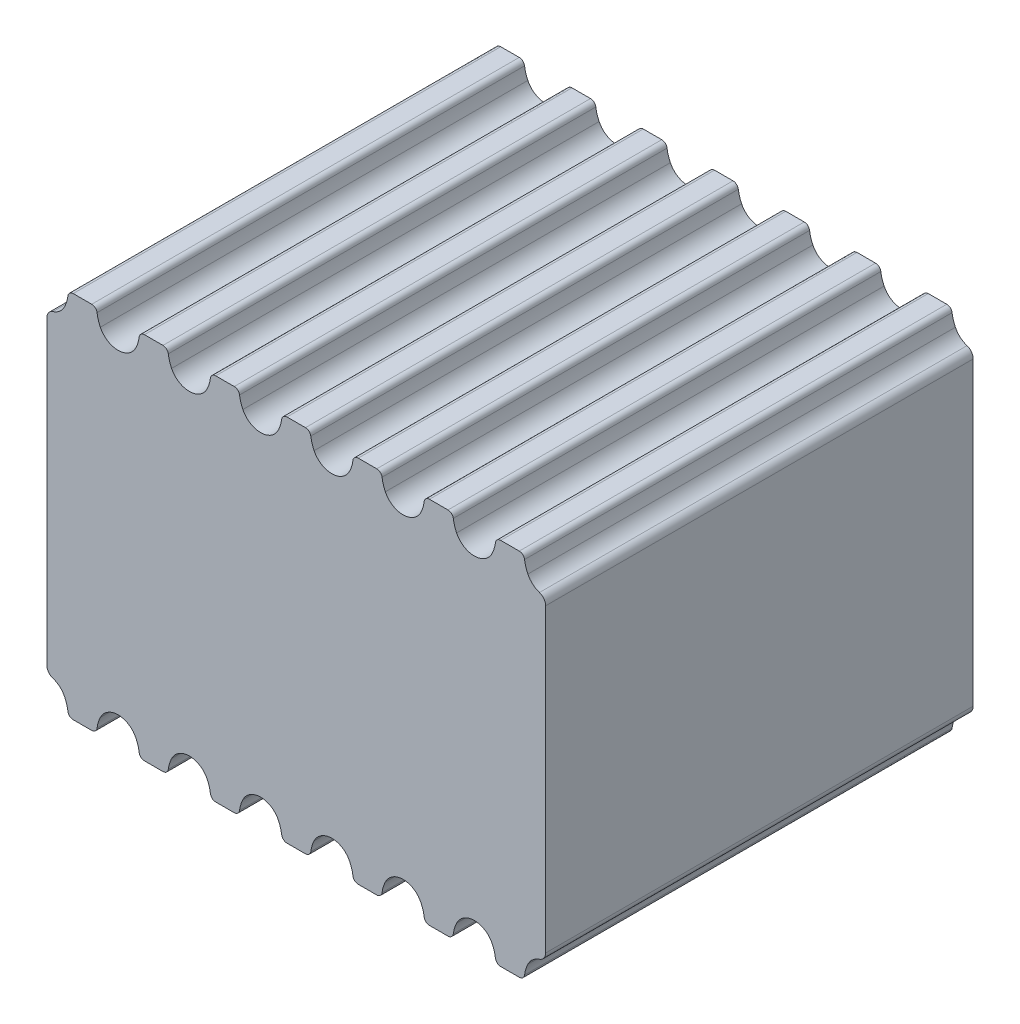
from build123d import *

# Parameters (mm, degrees)
BOSS_EXTRUDE1_DEPTH = 6.35
LPATTERN1_COUNT     = 7
LPATTERN1_PITCH     = 2
SKETCH4_W           = 14
SKETCH4_H           = 5.95
BOSS_EXTRUDE3_DEPTH = 6
FILLET1_R           = 0.25


with BuildPart() as part:
    # Sketch1 → Boss-Extrude1 (new, symmetric)
    with BuildSketch(Plane.XY):
        with BuildLine():
            Line((0, 0), (0, -0.254))
            Line((0, -0.254), (0.259824575, -0.254))
            ThreePointArc((0.259824575, -0.254), (0.358731646, -0.291228588), (0.408543109, -0.384434783))
            ThreePointArc((0.408543109, -0.384434783), (0.442388286, -0.542062154), (0.501123596, -0.692202247))
            ThreePointArc((0.501123596, -0.692202247), (0.705850588, -0.919639059), (1, -1.004))
            Line((1, -1.004), (1, 0))
            Line((1, 0), (1, 0.516))
            Line((1, 0.516), (0, 0.516))
            Line((0, 0.516), (0, 0))
        make_face()
    extrude(amount=BOSS_EXTRUDE1_DEPTH, both=True)

    # Mirror1: part across plane


with BuildPart() as part_1:
    add(part.part)
    add(part.part.mirror(Plane(origin=(0, 0, 6.35), x_dir=(0, 0, 1), z_dir=(1, 0, 0))))


with BuildPart() as lpattern1_1:
    # LPattern1: pattern copy
    add(part_1.part.moved(Location(Vector(-1, 0, 0) * (1 * LPATTERN1_PITCH))))


with BuildPart() as lpattern1_2:
    # LPattern1: pattern copy
    add(part_1.part.moved(Location(Vector(-1, 0, 0) * (2 * LPATTERN1_PITCH))))


with BuildPart() as lpattern1_3:
    # LPattern1: pattern copy
    add(part_1.part.moved(Location(Vector(-1, 0, 0) * (3 * LPATTERN1_PITCH))))


with BuildPart() as lpattern1_4:
    # LPattern1: pattern copy
    add(part_1.part.moved(Location(Vector(-1, 0, 0) * (4 * LPATTERN1_PITCH))))


with BuildPart() as lpattern1_5:
    # LPattern1: pattern copy
    add(part_1.part.moved(Location(Vector(-1, 0, 0) * (5 * LPATTERN1_PITCH))))


with BuildPart() as lpattern1_6:
    # LPattern1: pattern copy
    add(part_1.part.moved(Location(Vector(-1, 0, 0) * (6 * LPATTERN1_PITCH))))


with BuildPart() as lpattern1_1_1:
    add(lpattern1_1.part)

    # Combine1: union LPattern1_4, part, LPattern1_3, LPattern1_2, LPattern1_5, LPattern1_6
    add(lpattern1_4.part)
    add(part_1.part)
    add(lpattern1_3.part)
    add(lpattern1_2.part)
    add(lpattern1_5.part)
    add(lpattern1_6.part)


with BuildPart() as body_2:
    # Sketch4 → Boss-Extrude3 (new, symmetric)
    with BuildSketch(Plane.XY):
        with Locations((-6, -2.459)):
            Rectangle(SKETCH4_W, SKETCH4_H)
    extrude(amount=BOSS_EXTRUDE3_DEPTH, both=True)

    # Combine2: cut LPattern1_1
    add(lpattern1_1_1.part, mode=Mode.SUBTRACT)

    # Mirror2: body 2 across plane


with BuildPart() as body_2_1:
    add(body_2.part)
    add(body_2.part.mirror(Plane(origin=(1, -5.434, 6), x_dir=(0, 0, 1), z_dir=(0, 1, 0))))

    # Fillet1
    fillet1_edges = [body_2_1.edges().sort_by_distance(p)[0] for p in [
        (1, -9.864, 0),
        (-13, -9.864, 0),
        (-13, -1.004, 0),
        (1, -1.004, 0),
    ]]
    fillet(fillet1_edges, radius=FILLET1_R)


solid = body_2_1.part
